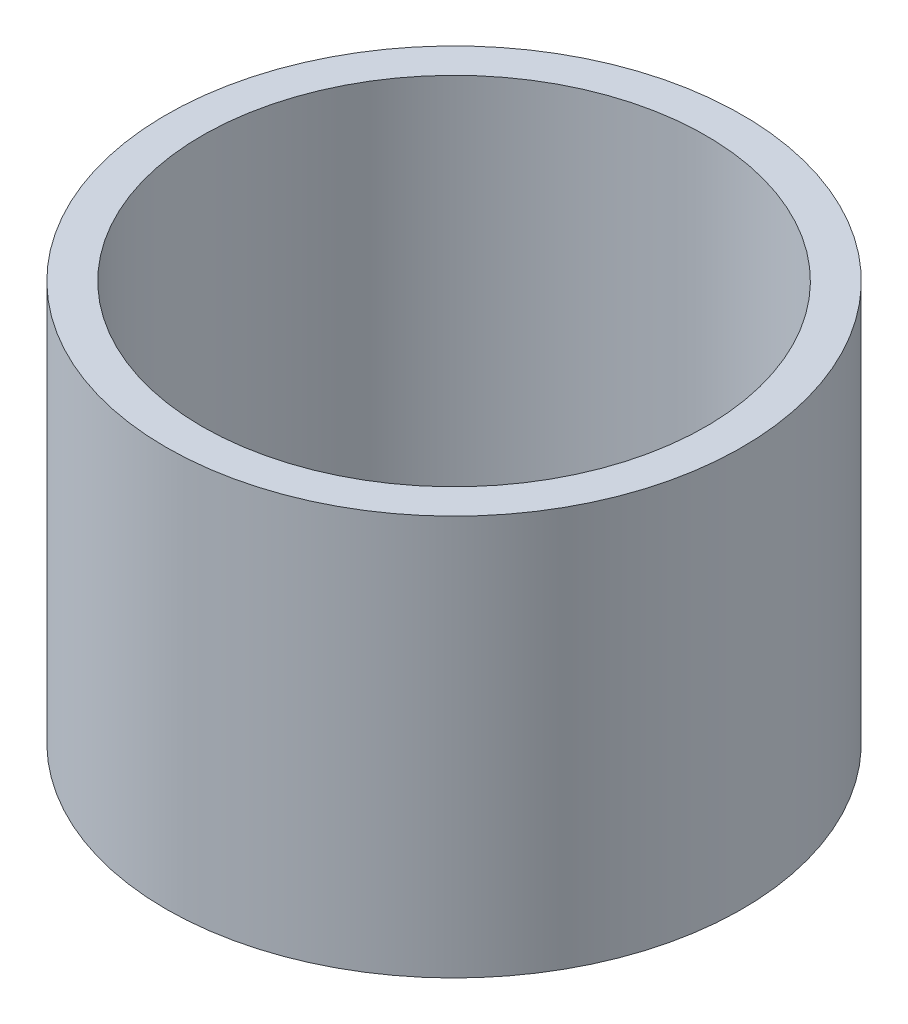
from build123d import *

# Parameters (mm, degrees)
SKETCH1_R           = 3.6
BOSS_EXTRUDE1_DEPTH = 5
SKETCH2_R           = 3.15
CUT_EXTRUDE1_DEPTH  = 4.5


with BuildPart() as part:
    # Sketch1 → Boss-Extrude1 (new body)
    with BuildSketch(Plane(origin=(0, 0, 0), x_dir=(1, 0, 0), z_dir=(0, 1, 0))):
        with Locations(Location((0, 0, 0), (0, 0, 270))):
            Circle(SKETCH1_R)
    extrude(amount=BOSS_EXTRUDE1_DEPTH)

    # Sketch2 → Cut-Extrude1 (cut)
    with BuildSketch(Plane(origin=(0, 5, 0), x_dir=(1, 0, 0), z_dir=(0, 1, 0))):
        with Locations(Location((0, 0, 0), (0, 0, 270))):
            Circle(SKETCH2_R)
    extrude(amount=-CUT_EXTRUDE1_DEPTH, mode=Mode.SUBTRACT)


solid = part.part
